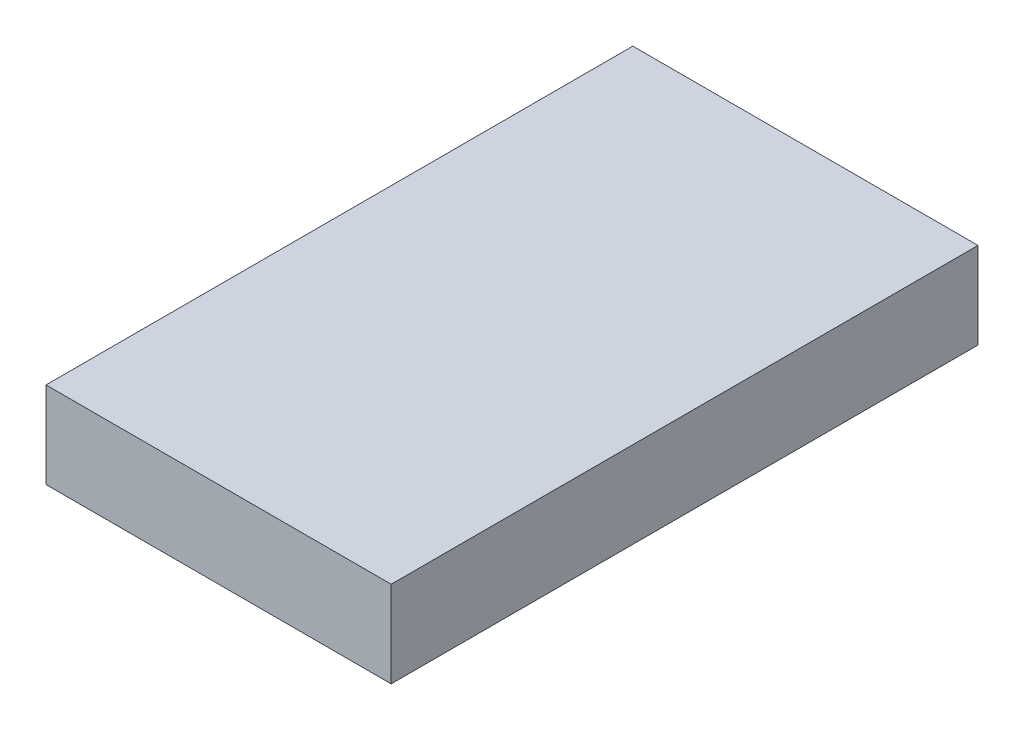
from build123d import *

# Parameters (mm, degrees)
SKETCH1_W           = 120
SKETCH1_H           = 204
BOSS_EXTRUDE1_DEPTH = 30
SHELL1_T            = 8
SKETCH2_W           = 104
SKETCH2_H           = 188
CUT_EXTRUDE1_DEPTH  = 18


with BuildPart() as part:
    # Sketch1 → Boss-Extrude1 (new body)
    with BuildSketch(Plane(origin=(0, 0, 0), x_dir=(1, 0, 0), z_dir=(0, 1, 0))):
        Rectangle(SKETCH1_W, SKETCH1_H)
    extrude(amount=BOSS_EXTRUDE1_DEPTH)

    # Shell1 (no face opened: a closed hollow body)
    add(offset(amount=-SHELL1_T, mode=Mode.PRIVATE), mode=Mode.SUBTRACT)

    # Sketch2 → Cut-Extrude1 (cut)
    with BuildSketch(Plane.XZ):
        Rectangle(SKETCH2_W, SKETCH2_H)
    extrude(amount=-CUT_EXTRUDE1_DEPTH, mode=Mode.SUBTRACT)


solid = part.part
